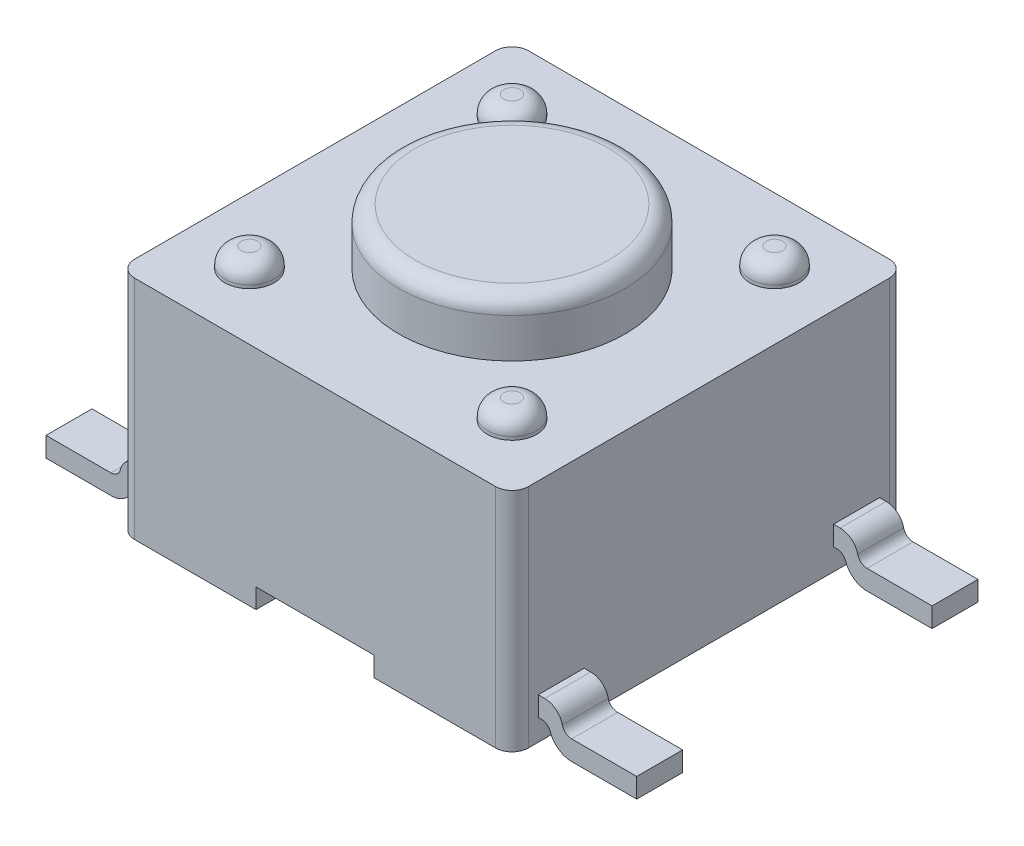
from build123d import *

# Parameters (mm, degrees)
SKETCH1_W           = 6
SKETCH1_H           = 6
BOSS_EXTRUDE1_DEPTH = 3.45
BOSS_EXTRUDE2_START = -3.45
SKETCH2_R           = 1.725
BOSS_EXTRUDE2_DEPTH = 4.3
SKETCH3_R           = 0.375
BOSS_EXTRUDE3_DEPTH = 0.3
FILLET1_R           = 0.25
BOSS_EXTRUDE4_DEPTH = 0.35
SKETCH5_W           = 1.8
SKETCH5_H           = 0.3
CUT_EXTRUDE1_DEPTH  = 9.645229899
FILLET2_R           = 0.25
FILLET3_R           = 0.25


with BuildPart() as part:
    # Sketch1 → Boss-Extrude1 (new body)
    with BuildSketch(Plane(origin=(0, 0, 0), x_dir=(1, 0, 0), z_dir=(0, 1, 0))):
        Rectangle(SKETCH1_W, SKETCH1_H)
    extrude(amount=BOSS_EXTRUDE1_DEPTH)

    # Sketch2 → Boss-Extrude2 (add)
    with BuildSketch(Plane(origin=(0, 3.45, 0), x_dir=(1, 0, 0), z_dir=(0, 1, 0)).offset(BOSS_EXTRUDE2_START)):
        with Locations(Location((0, 0, 0), (0, 0, 90))):
            Circle(SKETCH2_R)
    extrude(amount=BOSS_EXTRUDE2_DEPTH)

    # Sketch5 → Cut-Extrude1 (cut, through all)
    with BuildSketch(Plane.XY.offset(3)):
        with Locations((0, 0.15)):
            Rectangle(SKETCH5_W, SKETCH5_H)
    extrude(amount=-CUT_EXTRUDE1_DEPTH, mode=Mode.SUBTRACT)

    # Fillet2
    fillet2_edges = [part.edges().sort_by_distance(p)[0] for p in [
        (3, 1.725, 3),
        (-3, 1.725, 3),
        (-3, 1.725, -3),
        (3, 1.725, -3),
    ]]
    fillet(fillet2_edges, radius=FILLET2_R)

    # Fillet3
    fillet3_edges = [part.edges().sort_by_distance(p)[0] for p in [
        (0, 4.3, 1.725),
    ]]
    fillet(fillet3_edges, radius=FILLET3_R)


with BuildPart() as body_2:
    # Sketch3 → Boss-Extrude3 (new body)
    with BuildSketch(Plane(origin=(0, 3.45, 0), x_dir=(1, 0, 0), z_dir=(0, 1, 0))):
        with Locations(Location((2, -2, 0), (0, 0, 270))):
            Circle(SKETCH3_R)
    extrude(amount=BOSS_EXTRUDE3_DEPTH)

    # Fillet1
    fillet1_edges = [body_2.edges().sort_by_distance(p)[0] for p in [
        (2, 3.75, 1.625),
    ]]
    fillet(fillet1_edges, radius=FILLET1_R)


with BuildPart() as body_3:
    # Sketch4 → Boss-Extrude4 (new, symmetric)
    with BuildSketch(Plane.XY.offset(2.25)):
        with BuildLine():
            Line((3.509281367, 0), (4.5, 0))
            Line((4.5, 0), (4.5, 0.3))
            Line((4.5, 0.3), (3.509281367, 0.3))
            ThreePointArc((3.509281367, 0.3), (3.418042895, 0.332032002), (3.366851512, 0.414068275))
            ThreePointArc((3.366851512, 0.414068275), (3.270941157, 0.567768521), (3.1, 0.627782541))
            Line((3.1, 0.627782541), (3, 0.627782541))
            Line((3, 0.627782541), (3, 0.327782541))
            Line((3, 0.327782541), (3.048875475, 0.327782541))
            ThreePointArc((3.048875475, 0.327782541), (3.131374008, 0.301415278), (3.183287911, 0.232088609))
            ThreePointArc((3.183287911, 0.232088609), (3.309195851, 0.063949105), (3.509281367, 0))
        make_face()
    extrude(amount=BOSS_EXTRUDE4_DEPTH, both=True)


with BuildPart() as body_4:
    # Mirror3: mirrored copy
    add(body_2.part.mirror(Plane(origin=(0, 0, 0), x_dir=(0, 0, 1), z_dir=(1, 0, 0))))


with BuildPart() as body_5:
    # Mirror3 2: mirrored copy
    add(body_3.part.mirror(Plane(origin=(0, 0, 0), x_dir=(0, 0, 1), z_dir=(1, 0, 0))))


with BuildPart() as body_6:
    # Mirror4: mirrored copy
    add(body_5.part.mirror(Plane.XY))


with BuildPart() as body_7:
    # Mirror4 2: mirrored copy
    add(body_4.part.mirror(Plane.XY))


with BuildPart() as body_8:
    # Mirror4 3: mirrored copy
    add(body_3.part.mirror(Plane.XY))


with BuildPart() as body_9:
    # Mirror4 4: mirrored copy
    add(body_2.part.mirror(Plane.XY))


solid = Compound([part.part, body_2.part, body_3.part, body_4.part, body_5.part, body_6.part, body_7.part, body_8.part, body_9.part])
